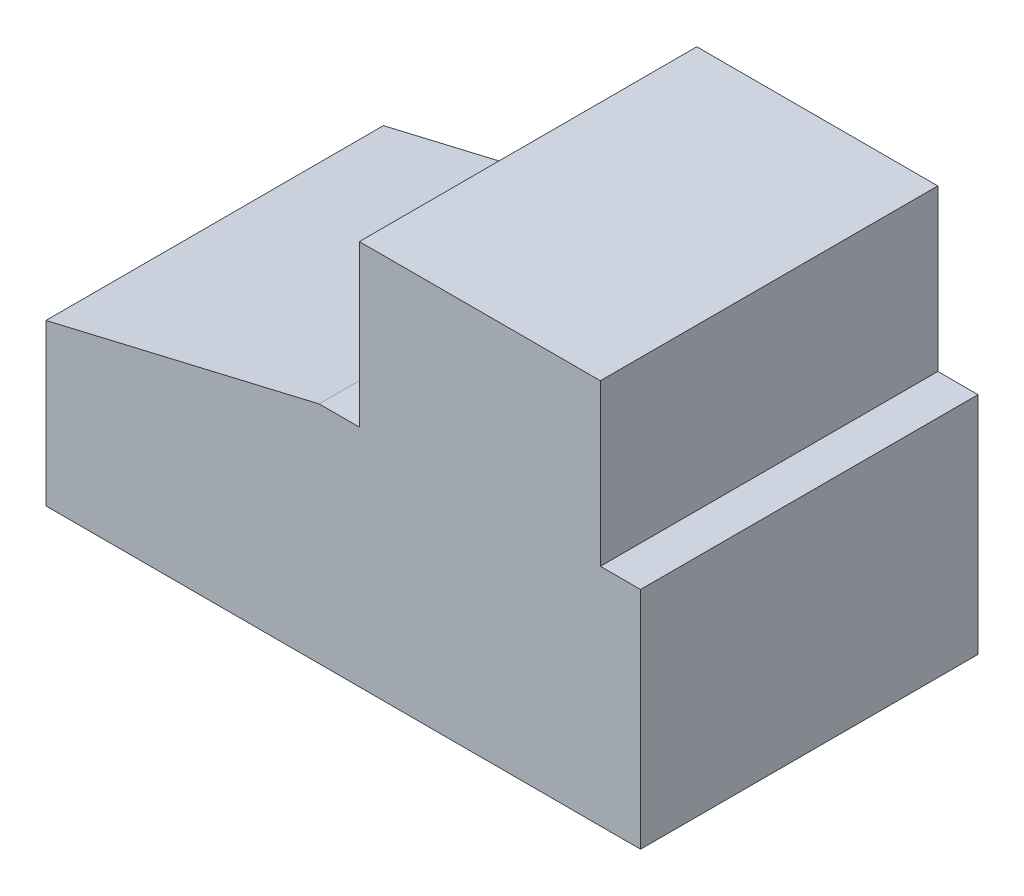
from build123d import *

# Parameters (mm, degrees)
BOSS_EXTRUDE1_DEPTH = 42


with BuildPart() as part:
    # Sketch1 → Boss-Extrude1 (new body)
    with BuildSketch(Plane.XY):
        Polygon((0, 20), (34, 28), (39, 28), (39, 48), (69, 48), (69, 28), (74, 28), (74, 0), (0, 0), align=None)
    extrude(amount=BOSS_EXTRUDE1_DEPTH)


solid = part.part
